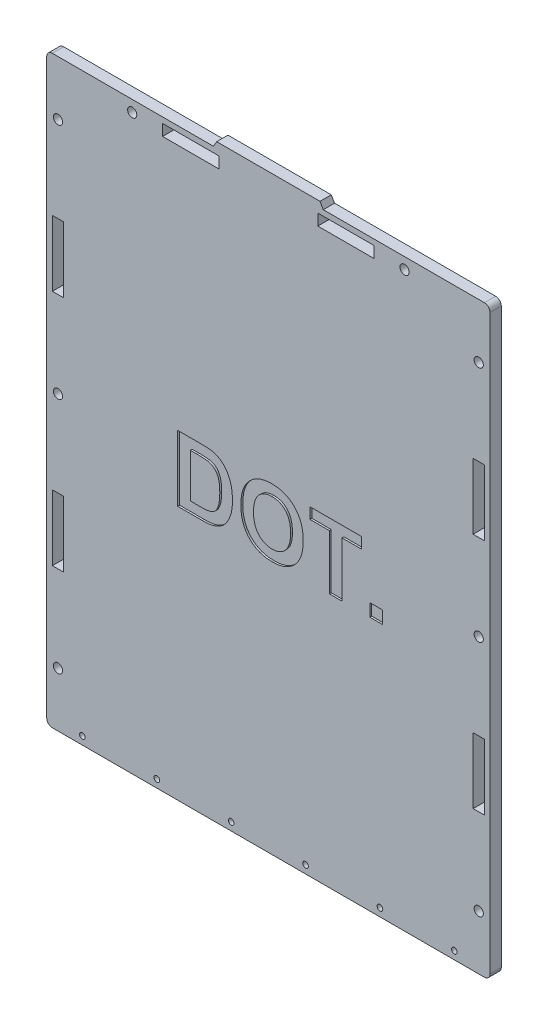
from build123d import *

# Parameters (mm, degrees)
SKETCH_1_R               = 2.45
SKETCH_1_W               = 6
SKETCH_1_H               = 35
SKETCH_1_W_2             = 30
SKETCH_1_H_2             = 6
EXTRUDE_1_DEPTH          = 6
FILLET_1_R               = 3
CUT_EXTRUDE_1_DEPTH      = 325.289993678
CUT_EXTRUDE_1_DEPTH_BACK = 325.289993678
SKETCH_2_R               = 1.5
SKETCH_3_W               = 6.730769231
SKETCH_3_H               = 6.730769231
CUT_EXTRUDE_2_DEPTH      = 1


with BuildPart() as part:
    # Эскиз1 → Бобышка-Вытянуть1 (new body)
    with BuildSketch(Plane.XY):
        Polygon((-118, 9), (-118, -302), (118, -302), (118, 9), (29.232050808, 9), (27.5, 12), (-27.5, 12), (-29.232050808, 9), align=None)
        with Locations((-72.5, 3)):
            Circle(SKETCH_1_R, mode=Mode.SUBTRACT)
        with Locations((-112, -20)):
            Circle(SKETCH_1_R, mode=Mode.SUBTRACT)
        with Locations((-112, -146.5)):
            Circle(SKETCH_1_R, mode=Mode.SUBTRACT)
        with Locations((-112, -273)):
            Circle(SKETCH_1_R, mode=Mode.SUBTRACT)
        with Locations((112, -273)):
            Circle(SKETCH_1_R, mode=Mode.SUBTRACT)
        with Locations((112, -146.5)):
            Circle(SKETCH_1_R, mode=Mode.SUBTRACT)
        with Locations((112, -20)):
            Circle(SKETCH_1_R, mode=Mode.SUBTRACT)
        with Locations((72.5, 3)):
            Circle(SKETCH_1_R, mode=Mode.SUBTRACT)
        with Locations((-112, -209.75)):
            Rectangle(SKETCH_1_W, SKETCH_1_H, mode=Mode.SUBTRACT)
        with Locations((-112, -83.25)):
            Rectangle(SKETCH_1_W, SKETCH_1_H, mode=Mode.SUBTRACT)
        with Locations((-41.333333333, 3)):
            Rectangle(SKETCH_1_W_2, SKETCH_1_H_2, mode=Mode.SUBTRACT)
        with Locations((112, -209.75)):
            Rectangle(SKETCH_1_W, SKETCH_1_H, mode=Mode.SUBTRACT)
        with Locations((112, -83.25)):
            Rectangle(SKETCH_1_W, SKETCH_1_H, mode=Mode.SUBTRACT)
        with Locations((41.333333333, 3)):
            Rectangle(SKETCH_1_W_2, SKETCH_1_H_2, mode=Mode.SUBTRACT)
    extrude(amount=EXTRUDE_1_DEPTH)

    # Скругление1
    fillet_1_edges = [part.edges().sort_by_distance(p)[0] for p in [
        (-118, 9, 3),
        (-118, -302, 3),
        (118, -302, 3),
        (118, 9, 3),
    ]]
    fillet(fillet_1_edges, radius=FILLET_1_R)

    # Эскиз2 → Вырез-Вытянуть1 (cut, two sides: drawn at the far end of the back side and taken through both)
    with BuildSketch(Plane.XY.offset(6).offset(-CUT_EXTRUDE_1_DEPTH_BACK)):
        with Locations((-99, -297.75)):
            Circle(SKETCH_2_R)
        with Locations((-59.4, -297.75)):
            Circle(SKETCH_2_R)
        with Locations((-19.8, -297.75)):
            Circle(SKETCH_2_R)
        with Locations((19.8, -297.75)):
            Circle(SKETCH_2_R)
        with Locations((59.4, -297.75)):
            Circle(SKETCH_2_R)
        with Locations((99, -297.75)):
            Circle(SKETCH_2_R)
    extrude(amount=CUT_EXTRUDE_1_DEPTH + CUT_EXTRUDE_1_DEPTH_BACK, mode=Mode.SUBTRACT)

    # Эскиз3 → Вырез-Вытянуть2 (cut)
    # profile 1 of 4: a face of its own
    with BuildSketch(Plane.XY.offset(6)):
        with BuildLine():
            Line((-48.294871795, -131.5), (-35.457331731, -131.5))
            add(Edge.make_bspline(
                [(-35.457331731, -131.5), (-35.10671767, -131.499818238), (-34.42399065, -131.499464305), (-33.433175, -131.540568763), (-32.506634986, -131.581914442), (-31.647030003, -131.664679449), (-30.851377825, -131.751431852), (-30.118250671, -131.861266923), (-29.452279754, -132.002032587), (-29.032318871, -132.113043151), (-28.831730769, -132.166065705)],
                knots=[0, 0, 0, 0, 1.259756885, 2.453039283, 3.563158368, 4.591894114, 5.55549294, 6.43918076, 7.254497783, 8, 8, 8, 8], degree=3))
            add(Edge.make_bspline(
                [(-28.831730769, -132.166065705), (-28.580883091, -132.247820877), (-28.083706093, -132.409858619), (-27.354829322, -132.693775719), (-26.664256533, -133.045890184), (-25.986368295, -133.416027991), (-25.351427477, -133.853672896), (-24.725831763, -134.308983838), (-24.150181315, -134.83641393), (-23.395289782, -135.573532215), (-22.533901162, -136.600361301), (-21.631465323, -137.962398483), (-20.867643197, -139.457421679), (-20.345764806, -140.79691041), (-19.993372252, -141.935588977), (-19.763017083, -142.848520458), (-19.567344382, -143.810177339), (-19.406696488, -144.820802052), (-19.281877698, -145.880394735), (-19.188948781, -146.988672964), (-19.143683025, -148.14659414), (-19.133434114, -148.934532853), (-19.128205128, -149.336538462)],
                knots=[0, 0, 0, 0, 0.745524535, 1.477620414, 2.207090574, 2.934465325, 3.657932502, 4.384347339, 5.118673636, 5.861150177, 7.365375624, 8.894729774, 10.468936425, 12.099947606, 12.950091786, 13.83580991, 14.759228729, 15.722225242, 16.726454549, 17.773376212, 18.863978586, 20, 20, 20, 20], degree=3))
            add(Edge.make_bspline(
                [(-19.128205128, -149.336538462), (-19.137750427, -150.031327542), (-19.156210844, -151.375035675), (-19.370075949, -153.314000901), (-19.678282582, -155.114947748), (-20.025695387, -156.238456691), (-20.193910256, -156.782451923)],
                knots=[0, 0, 0, 0, 1.103207939, 2.133582005, 3.096293362, 4, 4, 4, 4], degree=3))
            add(Edge.make_bspline(
                [(-20.193910256, -156.782451923), (-20.304987806, -157.094608246), (-20.523494676, -157.708668432), (-20.905865314, -158.594453264), (-21.319019488, -159.437408542), (-21.766384148, -160.236870121), (-22.250219509, -160.989242001), (-22.772335283, -161.692273794), (-23.324638275, -162.355221127), (-23.724749837, -162.76326835), (-23.923878205, -162.966346154)],
                knots=[0, 0, 0, 0, 1.090884612, 2.145940218, 3.175104604, 4.181306866, 5.161203701, 6.118658341, 7.063689906, 8, 8, 8, 8], degree=3))
            add(Edge.make_bspline(
                [(-23.923878205, -162.966346154), (-24.246116015, -163.256137149), (-24.910616312, -163.85372749), (-26.081579639, -164.593269418), (-27.405097468, -165.246748998), (-28.362449342, -165.582430611), (-28.859775641, -165.756810897)],
                knots=[0, 0, 0, 0, 0.908140292, 1.872714733, 2.8949153, 4, 4, 4, 4], degree=3))
            add(Edge.make_bspline(
                [(-28.859775641, -165.756810897), (-29.059974716, -165.818297995), (-29.475477538, -165.945911286), (-30.134298232, -166.082204919), (-30.837605852, -166.22579161), (-31.593510508, -166.312290448), (-32.394165544, -166.4035073), (-33.245951446, -166.454720464), (-34.145915517, -166.491078835), (-34.763178807, -166.496982186), (-35.078725962, -166.5)],
                knots=[0, 0, 0, 0, 0.799129865, 1.658552685, 2.566799617, 3.538529252, 4.561352959, 5.643373779, 6.795284424, 8, 8, 8, 8], degree=3))
            Line((-35.078725962, -166.5), (-48.294871795, -166.5))
            Line((-48.294871795, -166.5), (-48.294871795, -131.5))
        make_face()
        with BuildLine():
            Line((-41.564102564, -137.333333333), (-41.564102564, -160.666666667))
            Line((-41.564102564, -160.666666667), (-36.025240385, -160.666666667))
            add(Edge.make_bspline(
                [(-36.025240385, -160.666666667), (-35.775175278, -160.664683479), (-35.293704419, -160.660865086), (-34.597003756, -160.649645203), (-33.956741705, -160.619270846), (-33.369564187, -160.587807967), (-32.836999849, -160.535825782), (-32.356731417, -160.484699321), (-31.931432305, -160.413174473), (-31.668757122, -160.356713703), (-31.545072115, -160.330128205)],
                knots=[0, 0, 0, 0, 1.333384787, 2.567275092, 3.714769766, 4.750907381, 5.701951617, 6.567520054, 7.325492842, 8, 8, 8, 8], degree=3))
            add(Edge.make_bspline(
                [(-31.545072115, -160.330128205), (-31.255387809, -160.252826061), (-30.69115919, -160.102261876), (-29.898925168, -159.766610973), (-29.182055444, -159.361684878), (-28.528544646, -158.87477866), (-27.939596141, -158.259441814), (-27.436856597, -157.472474241), (-26.971584402, -156.533904385), (-26.652965892, -155.635458312), (-26.424262134, -154.832987292), (-26.269448455, -154.15945356), (-26.14710339, -153.430758169), (-26.041870677, -152.649777019), (-25.956840142, -151.817514409), (-25.90393012, -150.930964905), (-25.867818703, -149.991213726), (-25.861978322, -149.345923457), (-25.858974359, -149.014022436)],
                knots=[0, 0, 0, 0, 1.038686998, 2.023088296, 2.974059649, 3.888265163, 4.839857954, 5.909819677, 7.113156087, 8.466843969, 9.20827164, 10.006482943, 10.861893492, 11.769681931, 12.739021491, 13.762258324, 14.849031541, 16, 16, 16, 16], degree=3))
            add(Edge.make_bspline(
                [(-25.858974359, -149.014022436), (-25.861955221, -148.682120395), (-25.867729713, -148.039163612), (-25.903785743, -147.106419659), (-25.956398564, -146.233830842), (-26.042034657, -145.420318496), (-26.145636092, -144.6647583), (-26.269414222, -143.966510866), (-26.423294662, -143.330158581), (-26.652192947, -142.574160315), (-26.999190956, -141.72439478), (-27.471387526, -140.795307101), (-28.051261165, -140.003419505), (-28.691965074, -139.31549381), (-29.430707503, -138.749365722), (-30.248493587, -138.275200479), (-31.163128864, -137.907172042), (-31.813737672, -137.750416658), (-32.148036859, -137.669871795)],
                knots=[0, 0, 0, 0, 1.117996097, 2.165769068, 3.143980016, 4.062055362, 4.920439205, 5.712587309, 6.449616741, 7.124491204, 8.371470382, 9.537068822, 10.625202851, 11.666538334, 12.693249444, 13.747832046, 14.842779399, 16, 16, 16, 16], degree=3))
            add(Edge.make_bspline(
                [(-32.148036859, -137.669871795), (-32.292737833, -137.642984328), (-32.611313992, -137.583788418), (-33.139960468, -137.514647251), (-33.760180577, -137.463338597), (-34.475136081, -137.410956967), (-35.281932065, -137.381059183), (-36.183944352, -137.349855987), (-37.177398452, -137.339197032), (-37.871530267, -137.335344065), (-38.233774038, -137.333333333)],
                knots=[0, 0, 0, 0, 0.578738571, 1.274160813, 2.095454135, 3.025967819, 4.093109015, 5.270126069, 6.575371698, 8, 8, 8, 8], degree=3))
            Line((-38.233774038, -137.333333333), (-41.564102564, -137.333333333))
        make_face(mode=Mode.SUBTRACT)
    # profile 2 of 4: a face of its own
    with BuildSketch(Plane.XY.offset(6)):
        with BuildLine():
            add(Edge.make_bspline(
                [(-14.641025641, -149.210336538), (-14.638548834, -148.777820983), (-14.633684705, -147.928416263), (-14.549400633, -146.68230765), (-14.438307659, -145.487866017), (-14.257392931, -144.349789544), (-14.044571161, -143.262751643), (-13.77838761, -142.227074982), (-13.457730691, -141.246391653), (-13.202645574, -140.620235946), (-13.077524038, -140.313100962)],
                knots=[0, 0, 0, 0, 1.141009212, 2.240794809, 3.294380675, 4.305229195, 5.280013876, 6.216333343, 7.125095522, 8, 8, 8, 8], degree=3))
            add(Edge.make_bspline(
                [(-13.077524038, -140.313100962), (-12.872997812, -139.876473005), (-12.466350923, -139.00835255), (-11.711143736, -137.781628559), (-10.855160917, -136.62472844), (-9.905449539, -135.54371714), (-8.886256033, -134.554868679), (-7.792772318, -133.708556777), (-6.663846587, -132.976199685), (-5.860924098, -132.607867596), (-5.463341346, -132.425480769)],
                knots=[0, 0, 0, 0, 1.031372299, 2.050613973, 3.077158538, 4.108712802, 5.127684358, 6.111366908, 7.06480644, 8, 8, 8, 8], degree=3))
            add(Edge.make_bspline(
                [(-5.463341346, -132.425480769), (-5.193463664, -132.314782966), (-4.647972055, -132.091034479), (-3.800213887, -131.811784645), (-2.920289375, -131.584906776), (-2.01456296, -131.382104396), (-1.074240792, -131.242265481), (-0.106921069, -131.125015358), (0.892690022, -131.063562529), (1.568839639, -131.055420065), (1.912459936, -131.051282051)],
                knots=[0, 0, 0, 0, 0.92659354, 1.872881803, 2.832850937, 3.813025581, 4.820167273, 5.851730198, 6.908245912, 8, 8, 8, 8], degree=3))
            add(Edge.make_bspline(
                [(1.912459936, -131.051282051), (2.527738688, -131.066705069), (3.731847662, -131.096888128), (5.490712743, -131.314896767), (7.155133143, -131.683024426), (8.71947477, -132.215105342), (10.197224896, -132.880218036), (11.57690228, -133.705214592), (12.860548874, -134.681166026), (14.04568538, -135.794688909), (15.11298569, -137.043842653), (16.042515593, -138.416958294), (16.822265512, -139.90760129), (17.464434592, -141.511658889), (17.957893139, -143.234370445), (18.314416482, -145.070875161), (18.52622021, -147.022525769), (18.551248621, -148.361444534), (18.564102564, -149.049078526)],
                knots=[0, 0, 0, 0, 1.064641025, 2.083517118, 3.061799897, 4.009540929, 4.938075217, 5.861300345, 6.78508344, 7.723570974, 8.670267188, 9.622657076, 10.586935816, 11.576069104, 12.607749008, 13.683335114, 14.81022093, 16, 16, 16, 16], degree=3))
            add(Edge.make_bspline(
                [(18.564102564, -149.049078526), (18.551545508, -149.732108024), (18.527099265, -151.061838847), (18.31134209, -152.998174769), (17.96959968, -154.821291313), (17.464201401, -156.527023815), (16.841198374, -158.128388156), (16.053424633, -159.606310807), (15.143361891, -160.980395439), (14.077577485, -162.216088573), (12.912387499, -163.336001968), (11.630369146, -164.300546983), (10.260735135, -165.126661367), (8.79104198, -165.79369613), (7.23086887, -166.314819029), (5.575124286, -166.685775478), (3.822959039, -166.902945192), (2.62354165, -166.93323784), (2.010616987, -166.948717949)],
                knots=[0, 0, 0, 0, 1.18845052, 2.313691126, 3.386664782, 4.412527756, 5.405809582, 6.372003093, 7.321919452, 8.268293321, 9.206237639, 10.129603466, 11.054616372, 11.9847576, 12.932764752, 13.912672021, 14.933336461, 16, 16, 16, 16], degree=3))
            add(Edge.make_bspline(
                [(2.010616987, -166.948717949), (1.390691117, -166.933202118), (0.177318096, -166.902833181), (-1.593535627, -166.686324516), (-3.265716295, -166.315245955), (-4.838033162, -165.792290001), (-6.321209717, -165.135388305), (-7.701552366, -164.317715619), (-8.979824125, -163.347061964), (-10.154749956, -162.240330932), (-11.219875348, -161.008270755), (-12.128645919, -159.643021104), (-12.916460748, -158.179534065), (-13.542739218, -156.595641314), (-14.045354452, -154.907639078), (-14.387931938, -153.105814453), (-14.604106311, -151.195126542), (-14.62849426, -149.884025893), (-14.641025641, -149.210336538)],
                knots=[0, 0, 0, 0, 1.080878253, 2.11558926, 3.1052859, 4.062802436, 5.000434901, 5.928596448, 6.853693179, 7.793554778, 8.738606028, 9.68692032, 10.647726704, 11.63151566, 12.651483354, 13.714466703, 14.825613081, 16, 16, 16, 16], degree=3))
        make_face()
        with BuildLine():
            add(Edge.make_bspline(
                [(-7.91025641, -148.978966346), (-7.903532456, -149.463108813), (-7.890511646, -150.400641489), (-7.751822784, -151.761447476), (-7.54135128, -153.033610229), (-7.231822016, -154.215685872), (-6.840790705, -155.308529551), (-6.361696287, -156.313055415), (-5.79651867, -157.230759607), (-5.130639504, -158.042268092), (-4.410210457, -158.766788749), (-3.632571573, -159.393681843), (-2.812215305, -159.933252551), (-1.934947, -160.359241799), (-1.019024178, -160.697310874), (-0.057330762, -160.947976713), (0.954915017, -161.085616875), (1.645643441, -161.105355598), (1.996594551, -161.115384615)],
                knots=[0, 0, 0, 0, 1.313550922, 2.543666373, 3.708465049, 4.810029406, 5.85539231, 6.85404609, 7.825601258, 8.772642133, 9.696587791, 10.59409323, 11.479048685, 12.35559886, 13.234601248, 14.125357077, 15.047515647, 16, 16, 16, 16], degree=3))
            add(Edge.make_bspline(
                [(1.996594551, -161.115384615), (2.347592941, -161.105558801), (3.038414417, -161.086220014), (4.049416453, -160.945765612), (5.013015691, -160.705843844), (5.925299821, -160.369507178), (6.790426909, -159.936753739), (7.607643422, -159.409279073), (8.372238722, -158.77953389), (9.091883591, -158.065538707), (9.739789079, -157.248640267), (10.300154667, -156.331094444), (10.779013039, -155.320476102), (11.170085529, -154.216407162), (11.471997211, -153.01681034), (11.673878861, -151.72105092), (11.813689223, -150.332833884), (11.826656928, -149.374306073), (11.833333333, -148.880809295)],
                knots=[0, 0, 0, 0, 0.949153107, 1.868086493, 2.754172764, 3.630100905, 4.492260106, 5.365378617, 6.254840125, 7.166615376, 8.102436631, 9.067266169, 10.06813181, 11.121736829, 12.23011542, 13.408501285, 14.665770308, 16, 16, 16, 16], degree=3))
            add(Edge.make_bspline(
                [(11.833333333, -148.880809295), (11.825792248, -148.392077492), (11.811188221, -147.445601913), (11.684002226, -146.07490981), (11.475695069, -144.799691044), (11.186125102, -143.620275965), (10.803440196, -142.536474526), (10.346367864, -141.545322966), (9.793702493, -140.651999506), (9.159863032, -139.856966691), (8.458490481, -139.15718453), (7.701500923, -138.544555228), (6.884593413, -138.034810406), (6.015740833, -137.605929295), (5.085897526, -137.287743962), (4.104512871, -137.055662264), (3.068809621, -136.912745998), (2.359301137, -136.894131347), (1.996594551, -136.884615385)],
                knots=[0, 0, 0, 0, 1.332337092, 2.580197383, 3.749299508, 4.852775005, 5.886662144, 6.878700295, 7.822989687, 8.743523536, 9.644687758, 10.519443927, 11.392806431, 12.264866173, 13.155606721, 14.065961015, 15.011303331, 16, 16, 16, 16], degree=3))
            add(Edge.make_bspline(
                [(1.996594551, -136.884615385), (1.633842121, -136.893984973), (0.924243957, -136.912313292), (-0.113073717, -137.05759574), (-1.097550047, -137.282761996), (-2.027261932, -137.619115749), (-2.903682492, -138.043878241), (-3.723570092, -138.570668395), (-4.493385187, -139.182258014), (-5.201041832, -139.892650479), (-5.845151488, -140.694645295), (-6.398083006, -141.598884259), (-6.869578604, -142.595491957), (-7.25641341, -143.687418436), (-7.54317762, -144.87766752), (-7.763579786, -146.158240011), (-7.887349468, -147.536886686), (-7.902456652, -148.487941741), (-7.91025641, -148.978966346)],
                knots=[0, 0, 0, 0, 0.981996942, 1.920933313, 2.83127778, 3.712125466, 4.592427284, 5.463259035, 6.34592384, 7.249932058, 8.173122297, 9.125107726, 10.113123258, 11.154048744, 12.256187849, 13.424658091, 14.670364834, 16, 16, 16, 16], degree=3))
        make_face(mode=Mode.SUBTRACT)
    # profile 3 of 4: a face of its own
    with BuildSketch(Plane.XY.offset(6)):
        Polygon((32.474358974, -166.5), (32.474358974, -137.333333333), (22.153846154, -137.333333333), (22.153846154, -131.5), (49.525641026, -131.5), (49.525641026, -137.333333333), (39.205128205, -137.333333333), (39.205128205, -166.5), align=None)
    # profile 4 of 4: a face of its own
    with BuildSketch(Plane.XY.offset(6)):
        with Locations((57.378205128, -163.134615385)):
            Rectangle(SKETCH_3_W, SKETCH_3_H)
    extrude(amount=-CUT_EXTRUDE_2_DEPTH, mode=Mode.SUBTRACT)


solid = part.part
